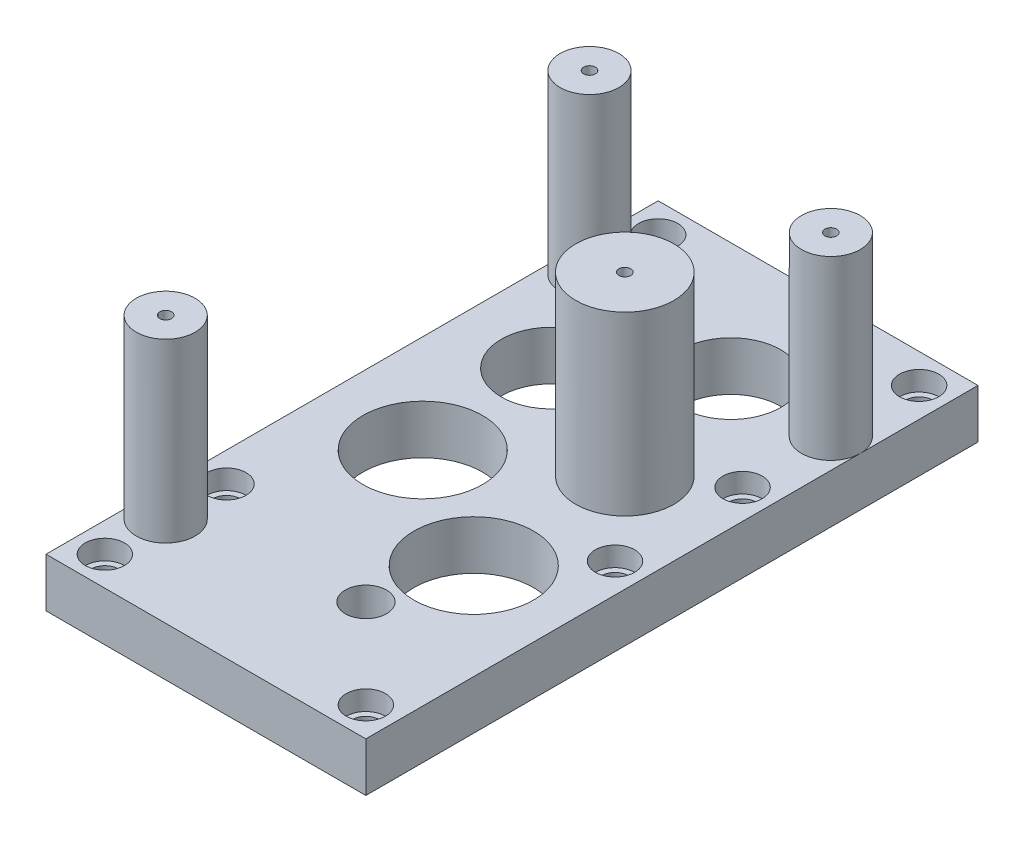
from build123d import *

# Parameters (mm, degrees)
SKETCH_1_W          = 16.3
SKETCH_1_H          = 31.2
SKETCH_1_R          = 3.05
SKETCH_1_R_2        = 1.05
SKETCH_1_R_3        = 2.55
EXTRUDE_1_DEPTH     = 2.5
SKETCH_2_R          = 1
CUT_EXTRUDE_1_DEPTH = 1
SKETCH_2_3_R        = 0.7
CUT_EXTRUDE_2_DEPTH = 21.5655051
SKETCH_3_R          = 1.5
SKETCH_3_R_2        = 2.5
EXTRUDE_2_DEPTH     = 9
CUT_EXTRUDE_START   = 9
SKETCH_3_3_R        = 0.3
CUT_EXTRUDE_3_DEPTH = 2
SKETCH_4_R          = 0.3
CUT_EXTRUDE_4_DEPTH = 2


with BuildPart() as part:
    # 草图1 → 凸台-拉伸1 (new body)
    with BuildSketch(Plane(origin=(0, 0, 0), x_dir=(1, 0, 0), z_dir=(0, 1, 0))):
        with Locations((3.15, 1.4)):
            Rectangle(SKETCH_1_W, SKETCH_1_H)
        with Locations(Location((0, 0, 0), (0, 0, 270))):
            Circle(SKETCH_1_R, mode=Mode.SUBTRACT)
        with Locations(Location((5.25646039, -8.152277238, 0), (0, 0, 270))):
            Circle(SKETCH_1_R_2, mode=Mode.SUBTRACT)
        with Locations(Location((6.4, -3.8, 0), (0, 0, 270))):
            Circle(SKETCH_1_R, mode=Mode.SUBTRACT)
        with Locations(Location((-0.337099263, 6.891760594, 0), (0, 0, 270))):
            Circle(SKETCH_1_R_3, mode=Mode.SUBTRACT)
        with Locations(Location((4.7, 11, 0), (0, 0, 270))):
            Circle(SKETCH_1_R_3, mode=Mode.SUBTRACT)
    extrude(amount=EXTRUDE_1_DEPTH)

    # 草图2 → 切除-拉伸1 (cut)
    with BuildSketch(Plane(origin=(0, 2.5, 0), x_dir=(1, 0, 0), z_dir=(0, 1, 0))):
        with Locations(Location((-3.5, 15.5, 0), (0, 0, 270))):
            Circle(SKETCH_2_R)
        with Locations(Location((-3.5, -12.7, 0), (0, 0, 270))):
            Circle(SKETCH_2_R)
        with Locations(Location((9.8, -12.7, 0), (0, 0, 270))):
            Circle(SKETCH_2_R)
        with Locations(Location((9.8, 15.5, 0), (0, 0, 270))):
            Circle(SKETCH_2_R)
        with Locations(Location((-3.5, -6.5, 0), (0, 0, 270))):
            Circle(SKETCH_2_R)
        with Locations(Location((9.8, 0, 0), (0, 0, 270))):
            Circle(SKETCH_2_R)
        with Locations(Location((9.8, 6.5, 0), (0, 0, 270))):
            Circle(SKETCH_2_R)
    extrude(amount=-CUT_EXTRUDE_1_DEPTH, mode=Mode.SUBTRACT)

    # 草图2<3> → 切除-拉伸2 (cut, through all)
    with BuildSketch(Plane(origin=(0, 2.5, 0), x_dir=(1, 0, 0), z_dir=(0, 1, 0))):
        with Locations(Location((9.8, 15.5, 0), (0, 0, 270))):
            Circle(SKETCH_2_3_R)
        with Locations(Location((9.8, -12.7, 0), (0, 0, 270))):
            Circle(SKETCH_2_3_R)
        with Locations(Location((-3.5, -12.7, 0), (0, 0, 270))):
            Circle(SKETCH_2_3_R)
        with Locations(Location((-3.5, 15.5, 0), (0, 0, 270))):
            Circle(SKETCH_2_3_R)
        with Locations(Location((-3.5, -6.5, 0), (0, 0, 270))):
            Circle(SKETCH_2_3_R)
        with Locations(Location((9.8, 0, 0), (0, 0, 270))):
            Circle(SKETCH_2_3_R)
        with Locations(Location((9.8, 6.5, 0), (0, 0, 270))):
            Circle(SKETCH_2_3_R)
    extrude(amount=-CUT_EXTRUDE_2_DEPTH, mode=Mode.SUBTRACT)

    # 草图3 → 凸台-拉伸2 (add)
    with BuildSketch(Plane(origin=(0, 2.5, 0), x_dir=(1, 0, 0), z_dir=(0, 1, 0))):
        with Locations(Location((-3.5, -9.6, 0), (0, 0, 180))):
            Circle(SKETCH_3_R)
        with Locations(Location((-3.5, 12, 0), (0, 0, 180))):
            Circle(SKETCH_3_R)
        with Locations(Location((6.3, 4, 0), (0, 0, 90))):
            Circle(SKETCH_3_R_2)
        with Locations((9.8, 11)):
            Circle(SKETCH_3_R)
    extrude(amount=EXTRUDE_2_DEPTH)

    # 草图3<3> → 切除-拉伸3 (cut)
    with BuildSketch(Plane(origin=(0, 2.5, 0), x_dir=(1, 0, 0), z_dir=(0, 1, 0)).offset(CUT_EXTRUDE_START)):
        with Locations(Location((-3.5, -9.6, 0), (0, 0, 270))):
            Circle(SKETCH_3_3_R)
        with Locations(Location((-3.5, 12, 0), (0, 0, 270))):
            Circle(SKETCH_3_3_R)
        with Locations(Location((6.3, 4, 0), (0, 0, 270))):
            Circle(SKETCH_3_3_R)
        with Locations(Location((9.8, 11, 0), (0, 0, 270))):
            Circle(SKETCH_3_3_R)
    extrude(amount=-CUT_EXTRUDE_3_DEPTH, mode=Mode.SUBTRACT)

    # 草图4 → 切除-拉伸4 (cut)
    with BuildSketch(Plane(origin=(0, 0, -17), x_dir=(-1, 0, 0), z_dir=(0, 0, -1))):
        with Locations((0.8, 1.187263162)):
            Circle(SKETCH_4_R)
        with Locations((-4.2, 1.187263162)):
            Circle(SKETCH_4_R)
    extrude(amount=-CUT_EXTRUDE_4_DEPTH, mode=Mode.SUBTRACT)


solid = part.part
